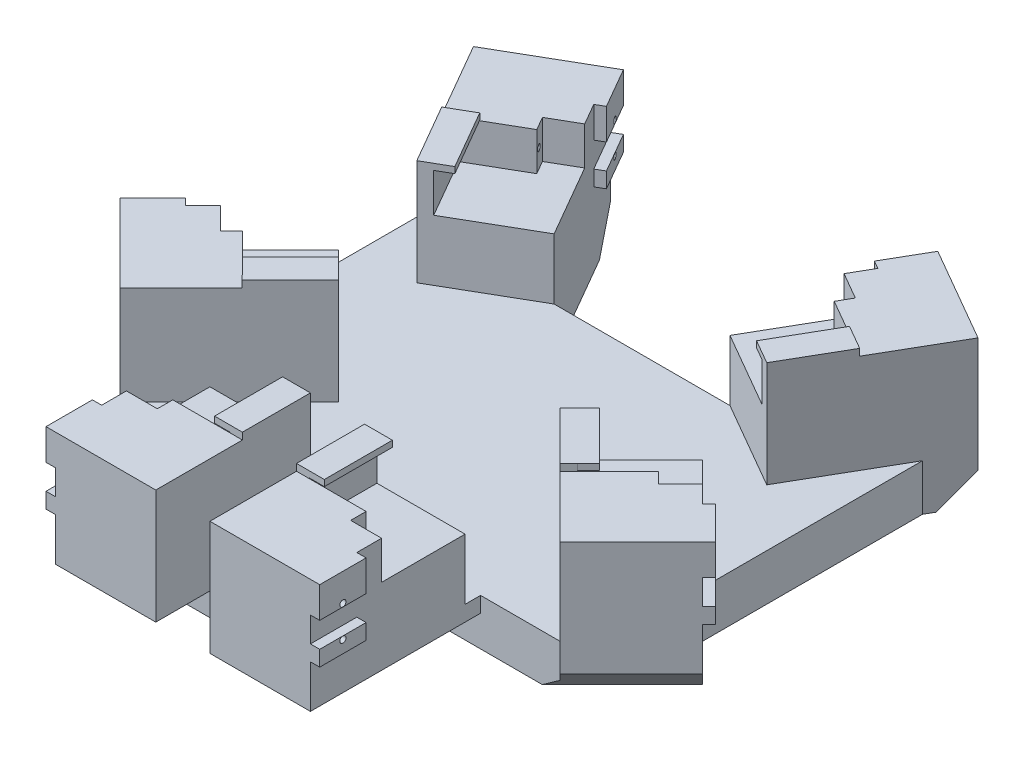
from build123d import *

# Parameters (mm, degrees)
SKETCH1_W            = 150
SKETCH1_H            = 150
BASE_DEPTH           = 7.5
SKETCH2_W            = 32.5
SKETCH2_H            = 50
MODELSERVOS_DEPTH    = 22
SKETCH3_W            = 33.75
SKETCH3_H            = 35
CUT_EXTRUDE1_DEPTH   = 137.81069005
SKETCH5_W            = 28.5
SKETCH5_H            = 22
CUT_EXTRUDE3_DEPTH   = 2.35
SKETCH6_W            = 3
SKETCH6_H            = 15
BOSS_EXTRUDE1_DEPTH  = 10
SKETCH8_W            = 15
SKETCH8_H            = 10
BOSS_EXTRUDE2_DEPTH  = 3
SKETCH9_W            = 15
SKETCH9_H            = 5
BOSS_EXTRUDE3_DEPTH  = 3
CUT_EXTRUDE4_DEPTH   = 2.35
BOSS_EXTRUDE4_DEPTH  = 10
SKETCH12_W           = 15
SKETCH12_H           = 10
BOSS_EXTRUDE5_DEPTH  = 3
SKETCH13_W           = 15
SKETCH13_H           = 5
BOSS_EXTRUDE6_DEPTH  = 3
CUT_EXTRUDE5_DEPTH   = 141.218353138
CUT_EXTRUDE6_DEPTH   = 2.35
BOSS_EXTRUDE7_DEPTH  = 10
SKETCH17_W           = 15
SKETCH17_H           = 10
BOSS_EXTRUDE8_DEPTH  = 3
SKETCH18_W           = 15
SKETCH18_H           = 5
BOSS_EXTRUDE9_DEPTH  = 3
BOSS_EXTRUDE10_DEPTH = 10
BOSS_EXTRUDE11_DEPTH = 10
BOSS_EXTRUDE12_DEPTH = 10
SKETCH27_W           = 32.5
SKETCH27_H           = 20
BOSS_EXTRUDE15_DEPTH = 15
BOSS_EXTRUDE14_DEPTH = 15
BOSS_EXTRUDE13_DEPTH = 15
SKETCH43_W           = 5
SKETCH43_H           = 12.35
CUT_EXTRUDE15_DEPTH  = 10
SKETCH37_R           = 1
CUT_EXTRUDE7_DEPTH   = 5
SKETCH38_R           = 1
CUT_EXTRUDE10_DEPTH  = 5
SKETCH44_W           = 5
SKETCH44_H           = 12.35
CUT_EXTRUDE16_DEPTH  = 10
SKETCH39_R           = 1
CUT_EXTRUDE11_DEPTH  = 5
SKETCH40_R           = 1
CUT_EXTRUDE12_DEPTH  = 5
SKETCH45_W           = 5
SKETCH45_H           = 12.35
CUT_EXTRUDE17_DEPTH  = 10
SKETCH41_R           = 1
CUT_EXTRUDE13_DEPTH  = 5
SKETCH42_R           = 1
CUT_EXTRUDE14_DEPTH  = 5
CHAMFER1_SIZE        = 10
SKETCH30_W           = 4
SKETCH30_H           = 22
F_10_2MM_DEPTH       = 2.2
SKETCH31_W           = 22
SKETCH31_H           = 2
F_2_X_5_MM_DEPTH     = 5
BOSS_EXTRUDE16_DEPTH = 2.2
SKETCH33_W           = 22
SKETCH33_H           = 2
BOSS_EXTRUDE17_DEPTH = 5
BOSS_EXTRUDE18_DEPTH = 2.2
SKETCH35_W           = 22
SKETCH35_H           = 2
BOSS_EXTRUDE19_DEPTH = 5


with BuildPart() as part:
    # Sketch1 → Base (new, symmetric)
    with BuildSketch(Plane(origin=(0, 0, 0), x_dir=(1, 0, 0), z_dir=(0, 1, 0))):
        Rectangle(SKETCH1_W, SKETCH1_H)
    extrude(amount=BASE_DEPTH, both=True)

    # Sketch2 → ModelServos (add)
    with BuildSketch(Plane(origin=(0, 7.5, 0), x_dir=(1, 0, 0), z_dir=(0, 1, 0))):
        with Locations((-25, -70)):
            Rectangle(SKETCH2_W, SKETCH2_H)
        Polygon((-81.572912811, 80.525635095), (-53.427087189, 96.775635095), (-28.427087189, 53.474364905), (-56.572912811, 37.224364905), align=None)
        Polygon((-58.812815665, 14.168154724), (-35.831845276, -8.812815665), (-71.187184335, -44.168154724), (-94.168154724, -21.187184335), align=None)
    modelservos = extrude(amount=MODELSERVOS_DEPTH)

    # Mirror1: ModelServos across plane
    add(modelservos.mirror(Plane(origin=(0, 0, 0), x_dir=(0, 0, 1), z_dir=(1, 0, 0))))

    # Sketch3 → Cut-Extrude1 (cut, through all)
    with BuildSketch(Plane(origin=(0, 7.5, 0), x_dir=(1, 0, 0), z_dir=(0, 1, 0))):
        with Locations((58.125, -57.5)):
            Rectangle(SKETCH3_W, SKETCH3_H)
    cut_extrude1 = extrude(amount=-CUT_EXTRUDE1_DEPTH, mode=Mode.SUBTRACT)

    # Mirror2: Cut-Extrude1 across plane
    add(cut_extrude1.mirror(Plane(origin=(0, 0, 0), x_dir=(0, 0, 1), z_dir=(1, 0, 0))), mode=Mode.SUBTRACT)

    # Sketch5 → Cut-Extrude3 (cut)
    with BuildSketch(Plane(origin=(0, 29.5, 0), x_dir=(1, 0, 0), z_dir=(0, 1, 0))):
        with Locations((27, -56)):
            Rectangle(SKETCH5_W, SKETCH5_H)
    cut_extrude3 = extrude(amount=-CUT_EXTRUDE3_DEPTH, mode=Mode.SUBTRACT)

    # Sketch6 → Boss-Extrude1 (add)
    with BuildSketch(Plane(origin=(0, 29.5, 0), x_dir=(1, 0, 0), z_dir=(0, 1, 0))):
        with Locations((39.75, -87.5)):
            Rectangle(SKETCH6_W, SKETCH6_H)
    boss_extrude1 = extrude(amount=BOSS_EXTRUDE1_DEPTH)

    # Sketch8 → Boss-Extrude2 (add)
    with BuildSketch(Plane(origin=(41.25, 0, 0), x_dir=(0, 0, -1), z_dir=(1, 0, 0))):
        with Locations((-87.5, 34.5)):
            Rectangle(SKETCH8_W, SKETCH8_H)
    boss_extrude2 = extrude(amount=BOSS_EXTRUDE2_DEPTH)

    # Sketch9 → Boss-Extrude3 (add)
    with BuildSketch(Plane(origin=(41.25, 0, 0), x_dir=(0, 0, -1), z_dir=(1, 0, 0))):
        with Locations((-87.5, 18.9)):
            Rectangle(SKETCH9_W, SKETCH9_H)
    boss_extrude3 = extrude(amount=BOSS_EXTRUDE3_DEPTH)

    # Sketch10 → Cut-Extrude4 (cut)
    with BuildSketch(Plane(origin=(0, 29.5, 0), x_dir=(1, 0, 0), z_dir=(0, 1, 0))):
        Polygon((58.812815665, 14.168154724), (38.660272401, -5.98438854), (54.216621587, -21.540737726), (74.369164851, -1.388194462), align=None)
    cut_extrude4 = extrude(amount=-CUT_EXTRUDE4_DEPTH, mode=Mode.SUBTRACT)

    # Sketch11 → Boss-Extrude4 (add)
    with BuildSketch(Plane(origin=(0, 29.5, 0), x_dir=(1, 0, 0), z_dir=(0, 1, 0))):
        Polygon((94.168154724, -21.187184335), (89.925514037, -25.429825023), (79.318912319, -14.823223305), (83.561553006, -10.580582618), align=None)
    boss_extrude4 = extrude(amount=BOSS_EXTRUDE4_DEPTH)

    # Sketch12 → Boss-Extrude5 (add)
    with BuildSketch(Plane(origin=(36.490485194, 0, -36.490485194), x_dir=(-0.7071067811865437, 0, -0.7071067811865515), z_dir=(0.7071067811865515, 0, -0.7071067811865437))):
        with Locations((-74.068542495, 34.5)):
            Rectangle(SKETCH12_W, SKETCH12_H)
    boss_extrude5 = extrude(amount=BOSS_EXTRUDE5_DEPTH)

    # Sketch13 → Boss-Extrude6 (add)
    with BuildSketch(Plane(origin=(36.490485194, 0, -36.490485194), x_dir=(-0.7071067811865437, 0, -0.7071067811865515), z_dir=(0.7071067811865515, 0, -0.7071067811865437))):
        with Locations((-74.068542495, 18.9)):
            Rectangle(SKETCH13_W, SKETCH13_H)
    boss_extrude6 = extrude(amount=BOSS_EXTRUDE6_DEPTH)

    # Sketch14 → Cut-Extrude5 (cut, through all)
    with BuildSketch(Plane(origin=(0, 7.5, 0), x_dir=(1, 0, 0), z_dir=(0, 1, 0))):
        Polygon((-28.427087189, 53.474364905), (28.427087189, 53.474364905), (40.854918405, 75), (-40.854918405, 75), align=None)
    extrude(amount=-CUT_EXTRUDE5_DEPTH, mode=Mode.SUBTRACT)

    # Sketch15 → Cut-Extrude6 (cut)
    with BuildSketch(Plane(origin=(0, 29.5, 0), x_dir=(1, 0, 0), z_dir=(0, 1, 0))):
        Polygon((28.427087189, 53.474364905), (39.427087189, 72.526923789), (64.108811196, 58.276923789), (53.108811196, 39.224364905), align=None)
    cut_extrude6 = extrude(amount=-CUT_EXTRUDE6_DEPTH, mode=Mode.SUBTRACT)

    # Sketch16 → Boss-Extrude7 (add)
    with BuildSketch(Plane(origin=(0, 29.5, 0), x_dir=(1, 0, 0), z_dir=(0, 1, 0))):
        Polygon((53.427087189, 96.775635095), (58.623239611, 93.775635095), (51.123239611, 80.785254038), (45.927087189, 83.785254038), align=None)
    boss_extrude7 = extrude(amount=BOSS_EXTRUDE7_DEPTH)

    # Sketch17 → Boss-Extrude8 (add)
    with BuildSketch(Plane(origin=(-1.834763838, 0, -1.059301396), x_dir=(-0.5000000000000018, 0, 0.8660254037844377), z_dir=(-0.8660254037844377, 0, -0.5000000000000018))):
        with Locations((-103.023702054, 34.5)):
            Rectangle(SKETCH17_W, SKETCH17_H)
    boss_extrude8 = extrude(amount=BOSS_EXTRUDE8_DEPTH)

    # Sketch18 → Boss-Extrude9 (add)
    with BuildSketch(Plane(origin=(-1.834763838, 0, -1.059301396), x_dir=(-0.5000000000000018, 0, 0.8660254037844377), z_dir=(-0.8660254037844377, 0, -0.5000000000000018))):
        with Locations((-103.023702054, 18.9)):
            Rectangle(SKETCH18_W, SKETCH18_H)
    boss_extrude9 = extrude(amount=BOSS_EXTRUDE9_DEPTH)

    # Sketch20 → Boss-Extrude10 (add)
    with BuildSketch(Plane(origin=(0, 29.5, 0), x_dir=(1, 0, 0), z_dir=(0, 1, 0))):
        Polygon((41.25, -67), (12.75, -67), (12.75, -45), (8.75, -45), (8.75, -95), (38.25, -95), (38.25, -80), (41.25, -80), align=None)
    boss_extrude10 = extrude(amount=BOSS_EXTRUDE10_DEPTH)

    # Sketch22 → Boss-Extrude11 (add)
    with BuildSketch(Plane(origin=(0, 29.5, 0), x_dir=(1, 0, 0), z_dir=(0, 1, 0))):
        Polygon((74.369164851, -1.388194462), (54.216621587, -21.540737726), (38.660272401, -5.98438854), (35.831845276, -8.812815665), (71.187184335, -44.168154724), (89.925514037, -25.429825023), (79.318912319, -14.823223305), (83.561553006, -10.580582618), align=None)
    boss_extrude11 = extrude(amount=BOSS_EXTRUDE11_DEPTH)

    # Sketch24 → Boss-Extrude12 (add)
    with BuildSketch(Plane(origin=(0, 29.5, 0), x_dir=(1, 0, 0), z_dir=(0, 1, 0))):
        Polygon((39.427087189, 72.526923789), (64.108811196, 58.276923789), (53.108811196, 39.224364905), (56.572912811, 37.224364905), (81.572912811, 80.525635095), (58.623239611, 93.775635095), (51.123239611, 80.785254038), (45.927087189, 83.785254038), align=None)
    boss_extrude12 = extrude(amount=BOSS_EXTRUDE12_DEPTH)

    # Sketch27 → Boss-Extrude15 (add)
    with BuildSketch(Plane.XZ.offset(-7.5)):
        with Locations((25, 85)):
            Rectangle(SKETCH27_W, SKETCH27_H)
    boss_extrude15 = extrude(amount=BOSS_EXTRUDE15_DEPTH)

    # Sketch26 → Boss-Extrude14 (add)
    with BuildSketch(Plane.XZ.offset(-7.5)):
        Polygon((94.168154724, 21.187184335), (71.187184335, 44.168154724), (67.019029611, 40), (75, 40), (75, 2.019029611), align=None)
    boss_extrude14 = extrude(amount=BOSS_EXTRUDE14_DEPTH)

    # Sketch25 → Boss-Extrude13 (add)
    with BuildSketch(Plane.XZ.offset(-7.5)):
        Polygon((75, -69.141016151), (75, -75), (40.854918405, -75), (53.427087189, -96.775635095), (81.572912811, -80.525635095), align=None)
    boss_extrude13 = extrude(amount=BOSS_EXTRUDE13_DEPTH)

    # Sketch43 → Cut-Extrude15 (cut)
    with BuildSketch(Plane(origin=(41.25, 0, 0), x_dir=(0, 0, -1), z_dir=(1, 0, 0))):
        with Locations((-69.5, 33.325)):
            Rectangle(SKETCH43_W, SKETCH43_H)
    cut_extrude15 = extrude(amount=-CUT_EXTRUDE15_DEPTH, mode=Mode.SUBTRACT)

    # Sketch37 → Cut-Extrude7 (cut)
    with BuildSketch(Plane(origin=(31.25, 0, 0), x_dir=(0, 0, -1), z_dir=(1, 0, 0))):
        with Locations((-68.9, 33.15)):
            Circle(SKETCH37_R)
    cut_extrude7 = extrude(amount=-CUT_EXTRUDE7_DEPTH, mode=Mode.SUBTRACT)

    # Sketch38 → Cut-Extrude10 (cut)
    with BuildSketch(Plane(origin=(44.25, 0, 0), x_dir=(0, 0, -1), z_dir=(1, 0, 0))):
        with Locations((-87.5, 30.51)):
            Circle(SKETCH38_R)
        with Locations((-87.5, 20.39)):
            Circle(SKETCH38_R)
    cut_extrude10 = extrude(amount=-CUT_EXTRUDE10_DEPTH, mode=Mode.SUBTRACT)

    # Sketch44 → Cut-Extrude16 (cut)
    with BuildSketch(Plane(origin=(36.490485194, 0, -36.490485194), x_dir=(-0.7071067811865434, 0, -0.7071067811865517), z_dir=(0.7071067811865517, 0, -0.7071067811865434))):
        with Locations((-56.068542495, 33.325)):
            Rectangle(SKETCH44_W, SKETCH44_H)
    cut_extrude16 = extrude(amount=-CUT_EXTRUDE16_DEPTH, mode=Mode.SUBTRACT)

    # Sketch39 → Cut-Extrude11 (cut)
    with BuildSketch(Plane(origin=(29.419417382, 0, -29.419417382), x_dir=(-0.7071067811865427, 0, -0.7071067811865525), z_dir=(0.7071067811865525, 0, -0.7071067811865427))):
        with Locations((-55.468542495, 33.15)):
            Circle(SKETCH39_R)
    cut_extrude11 = extrude(amount=-CUT_EXTRUDE11_DEPTH, mode=Mode.SUBTRACT)

    # Sketch40 → Cut-Extrude12 (cut)
    with BuildSketch(Plane(origin=(38.611805538, 0, -38.611805538), x_dir=(-0.7071067811865438, 0, -0.7071067811865513), z_dir=(0.7071067811865513, 0, -0.7071067811865438))):
        with Locations((-74.068542495, 30.51)):
            Circle(SKETCH40_R)
        with Locations((-74.068542495, 20.39)):
            Circle(SKETCH40_R)
    cut_extrude12 = extrude(amount=-CUT_EXTRUDE12_DEPTH, mode=Mode.SUBTRACT)

    # Sketch45 → Cut-Extrude17 (cut)
    with BuildSketch(Plane(origin=(-1.834763838, 0, -1.059301396), x_dir=(-0.5000000000000002, 0, 0.8660254037844386), z_dir=(-0.8660254037844386, 0, -0.5000000000000002))):
        with Locations((-85.023702054, 33.325)):
            Rectangle(SKETCH45_W, SKETCH45_H)
    cut_extrude17 = extrude(amount=-CUT_EXTRUDE17_DEPTH, mode=Mode.SUBTRACT)

    # Sketch41 → Cut-Extrude13 (cut)
    with BuildSketch(Plane(origin=(6.8254902, 0, 3.940698604), x_dir=(-0.4999999999999997, 0, 0.8660254037844388), z_dir=(-0.8660254037844389, 0, -0.49999999999999983))):
        with Locations((-84.423702054, 33.15)):
            Circle(SKETCH41_R)
    cut_extrude13 = extrude(amount=-CUT_EXTRUDE13_DEPTH, mode=Mode.SUBTRACT)

    # Sketch42 → Cut-Extrude14 (cut)
    with BuildSketch(Plane(origin=(-4.43284005, 0, -2.559301396), x_dir=(-0.500000000000002, 0, 0.8660254037844375), z_dir=(-0.8660254037844375, 0, -0.500000000000002))):
        with Locations((-103.023702054, 30.51)):
            Circle(SKETCH42_R)
        with Locations((-103.023702054, 20.39)):
            Circle(SKETCH42_R)
    cut_extrude14 = extrude(amount=-CUT_EXTRUDE14_DEPTH, mode=Mode.SUBTRACT)

    # Mirror4: Cut-Extrude3, Boss-Extrude1, Boss-Extrude2, Boss-Extrude3, Cut-Extrude4, Boss-Extrude4, Boss-Extrude5, Boss-Extrude6, Cut-Extrude6, Boss-Extrude7, Boss-Extrude8, Boss-Extrude9, Boss-Extrude10, Boss-Extrude11, Boss-Extrude12, Cut-Extrude15, Cut-Extrude7, Cut-Extrude10, Cut-Extrude16, Cut-Extrude11, Cut-Extrude12, Cut-Extrude17, Cut-Extrude13, Cut-Extrude14 across plane
    add(cut_extrude3.mirror(Plane(origin=(0, 0, 0), x_dir=(0, 0, 1), z_dir=(1, 0, 0))), mode=Mode.SUBTRACT)
    add(boss_extrude1.mirror(Plane(origin=(0, 0, 0), x_dir=(0, 0, 1), z_dir=(1, 0, 0))))
    add(boss_extrude2.mirror(Plane(origin=(0, 0, 0), x_dir=(0, 0, 1), z_dir=(1, 0, 0))))
    add(boss_extrude3.mirror(Plane(origin=(0, 0, 0), x_dir=(0, 0, 1), z_dir=(1, 0, 0))))
    add(cut_extrude4.mirror(Plane(origin=(0, 0, 0), x_dir=(0, 0, 1), z_dir=(1, 0, 0))), mode=Mode.SUBTRACT)
    add(boss_extrude4.mirror(Plane(origin=(0, 0, 0), x_dir=(0, 0, 1), z_dir=(1, 0, 0))))
    add(boss_extrude5.mirror(Plane(origin=(0, 0, 0), x_dir=(0, 0, 1), z_dir=(1, 0, 0))))
    add(boss_extrude6.mirror(Plane(origin=(0, 0, 0), x_dir=(0, 0, 1), z_dir=(1, 0, 0))))
    add(cut_extrude6.mirror(Plane(origin=(0, 0, 0), x_dir=(0, 0, 1), z_dir=(1, 0, 0))), mode=Mode.SUBTRACT)
    add(boss_extrude7.mirror(Plane(origin=(0, 0, 0), x_dir=(0, 0, 1), z_dir=(1, 0, 0))))
    add(boss_extrude8.mirror(Plane(origin=(0, 0, 0), x_dir=(0, 0, 1), z_dir=(1, 0, 0))))
    add(boss_extrude9.mirror(Plane(origin=(0, 0, 0), x_dir=(0, 0, 1), z_dir=(1, 0, 0))))
    add(boss_extrude10.mirror(Plane(origin=(0, 0, 0), x_dir=(0, 0, 1), z_dir=(1, 0, 0))))
    add(boss_extrude11.mirror(Plane(origin=(0, 0, 0), x_dir=(0, 0, 1), z_dir=(1, 0, 0))))
    add(boss_extrude12.mirror(Plane(origin=(0, 0, 0), x_dir=(0, 0, 1), z_dir=(1, 0, 0))))
    add(cut_extrude15.mirror(Plane(origin=(0, 0, 0), x_dir=(0, 0, 1), z_dir=(1, 0, 0))), mode=Mode.SUBTRACT)
    add(cut_extrude7.mirror(Plane(origin=(0, 0, 0), x_dir=(0, 0, 1), z_dir=(1, 0, 0))), mode=Mode.SUBTRACT)
    add(cut_extrude10.mirror(Plane(origin=(0, 0, 0), x_dir=(0, 0, 1), z_dir=(1, 0, 0))), mode=Mode.SUBTRACT)
    add(cut_extrude16.mirror(Plane(origin=(0, 0, 0), x_dir=(0, 0, 1), z_dir=(1, 0, 0))), mode=Mode.SUBTRACT)
    add(cut_extrude11.mirror(Plane(origin=(0, 0, 0), x_dir=(0, 0, 1), z_dir=(1, 0, 0))), mode=Mode.SUBTRACT)
    add(cut_extrude12.mirror(Plane(origin=(0, 0, 0), x_dir=(0, 0, 1), z_dir=(1, 0, 0))), mode=Mode.SUBTRACT)
    add(cut_extrude17.mirror(Plane(origin=(0, 0, 0), x_dir=(0, 0, 1), z_dir=(1, 0, 0))), mode=Mode.SUBTRACT)
    add(cut_extrude13.mirror(Plane(origin=(0, 0, 0), x_dir=(0, 0, 1), z_dir=(1, 0, 0))), mode=Mode.SUBTRACT)
    add(cut_extrude14.mirror(Plane(origin=(0, 0, 0), x_dir=(0, 0, 1), z_dir=(1, 0, 0))), mode=Mode.SUBTRACT)

    # Mirror5: Boss-Extrude15, Boss-Extrude14, Boss-Extrude13 across plane
    add(boss_extrude15.mirror(Plane(origin=(0, 0, 0), x_dir=(0, 0, 1), z_dir=(1, 0, 0))))
    add(boss_extrude14.mirror(Plane(origin=(0, 0, 0), x_dir=(0, 0, 1), z_dir=(1, 0, 0))))
    add(boss_extrude13.mirror(Plane(origin=(0, 0, 0), x_dir=(0, 0, 1), z_dir=(1, 0, 0))))

    # Chamfer1
    chamfer1_edges = [part.edges().sort_by_distance(p)[0] for p in [
        (41.25, -7.5, 67.5),
        (-41.25, -7.5, 67.5),
        (25, -7.5, 95),
        (82.67766953, -7.5, 32.67766953),
        (67.5, -7.5, -88.650635095),
        (-25, -7.5, 95),
        (-8.75, -7.5, 85),
        (-82.67766953, -7.5, 32.67766953),
        (-67.5, -7.5, -88.650635095),
    ]]
    chamfer(chamfer1_edges, length=CHAMFER1_SIZE)

    # Sketch30 → 10.2mm (add)
    with BuildSketch(Plane(origin=(0, 39.5, 0), x_dir=(1, 0, 0), z_dir=(0, 1, 0))):
        with Locations((10.75, -56)):
            Rectangle(SKETCH30_W, SKETCH30_H)
    f_10_2mm = extrude(amount=F_10_2MM_DEPTH)

    # Sketch31 → 2 x 5 mm (add)
    with BuildSketch(Plane(origin=(12.75, 0, 0), x_dir=(0, 0, -1), z_dir=(1, 0, 0))):
        with Locations((-56, 40.7)):
            Rectangle(SKETCH31_W, SKETCH31_H)
    f_2_x_5_mm = extrude(amount=F_2_X_5_MM_DEPTH)

    # Sketch32 → Boss-Extrude16 (add)
    with BuildSketch(Plane(origin=(0, 39.5, 0), x_dir=(1, 0, 0), z_dir=(0, 1, 0))):
        Polygon((54.216621587, -21.540737726), (51.425437444, -24.406407832), (35.831845276, -8.812815665), (38.660272401, -5.98438854), align=None)
    boss_extrude16 = extrude(amount=BOSS_EXTRUDE16_DEPTH)

    # Sketch33 → Boss-Extrude17 (add)
    with BuildSketch(Plane(origin=(16.33794193, 0, -16.33794193), x_dir=(-0.7071067811865479, 0, -0.7071067811865472), z_dir=(0.7071067811865472, 0, -0.7071067811865479))):
        with Locations((-42.568542495, 40.7)):
            Rectangle(SKETCH33_W, SKETCH33_H)
    boss_extrude17 = extrude(amount=BOSS_EXTRUDE17_DEPTH)

    # Sketch34 → Boss-Extrude18 (add)
    with BuildSketch(Plane(origin=(0, 39.5, 0), x_dir=(1, 0, 0), z_dir=(0, 1, 0))):
        Polygon((64.108811196, 58.276923789), (67.572912811, 56.276923789), (56.572912811, 37.224364905), (53.108811196, 39.224364905), align=None)
    boss_extrude18 = extrude(amount=BOSS_EXTRUDE18_DEPTH)

    # Sketch35 → Boss-Extrude19 (add)
    with BuildSketch(Plane(origin=(22.84696017, 0, 13.190698604), x_dir=(-0.5000000000000001, 0, 0.8660254037844386), z_dir=(-0.8660254037844386, 0, -0.5000000000000001))):
        with Locations((-71.523702054, 40.7)):
            Rectangle(SKETCH35_W, SKETCH35_H)
    boss_extrude19 = extrude(amount=BOSS_EXTRUDE19_DEPTH)

    # Mirror6: 10.2mm, 2 x 5 mm, Boss-Extrude16, Boss-Extrude17, Boss-Extrude18, Boss-Extrude19 across plane
    add(f_10_2mm.mirror(Plane(origin=(0, 0, 0), x_dir=(0, 0, 1), z_dir=(1, 0, 0))))
    add(f_2_x_5_mm.mirror(Plane(origin=(0, 0, 0), x_dir=(0, 0, 1), z_dir=(1, 0, 0))))
    add(boss_extrude16.mirror(Plane(origin=(0, 0, 0), x_dir=(0, 0, 1), z_dir=(1, 0, 0))))
    add(boss_extrude17.mirror(Plane(origin=(0, 0, 0), x_dir=(0, 0, 1), z_dir=(1, 0, 0))))
    add(boss_extrude18.mirror(Plane(origin=(0, 0, 0), x_dir=(0, 0, 1), z_dir=(1, 0, 0))))
    add(boss_extrude19.mirror(Plane(origin=(0, 0, 0), x_dir=(0, 0, 1), z_dir=(1, 0, 0))))


solid = part.part
